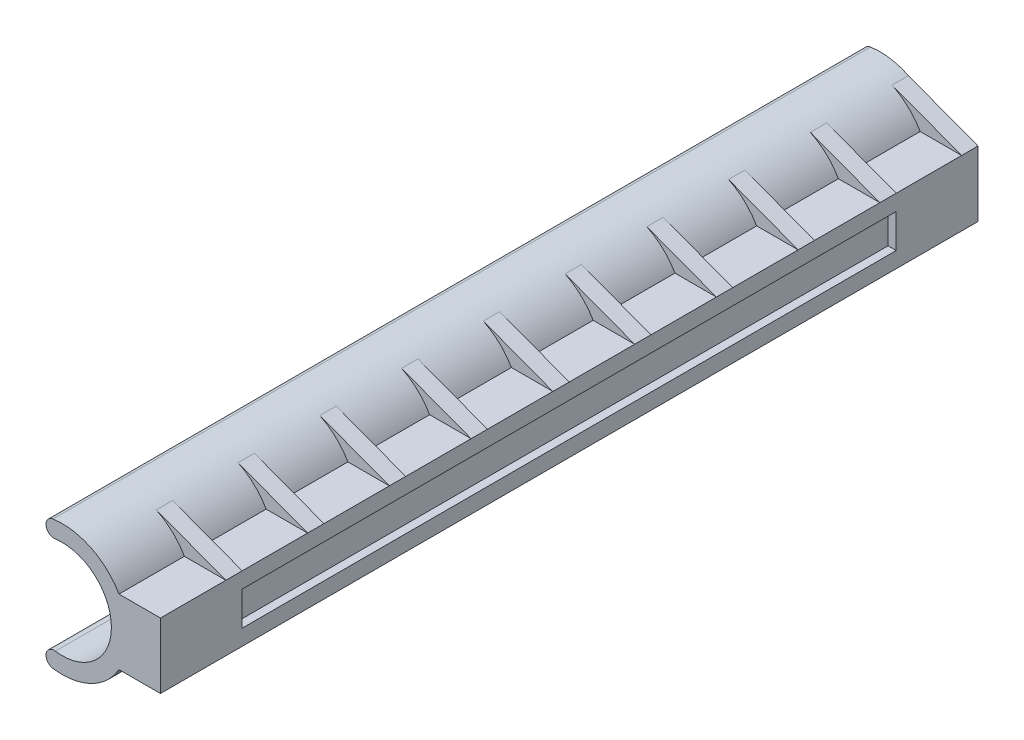
from build123d import *

# Parameters (mm, degrees)
BOSS_EXTRUDE1_DEPTH     = 500
BOSS_EXTRUDE2_START     = 30
SKETCH2_W               = 500
SKETCH2_H               = 40
BOSS_EXTRUDE2_DEPTH     = 30
RIB1_REACH              = 507.173
SKETCH4_WALL_W          = 1057.782982674
SKETCH4_WALL_H          = 10
LPATTERN1_COUNT         = 10
LPATTERN1_PITCH         = 50
MIRROR1_COPY_1_REACH    = 507.173
MIRROR1_COPY_1_SKETCH_W = 1057.782982674
MIRROR1_COPY_1_SKETCH_H = 10
MIRROR1_COPY_2_REACH    = 507.173
MIRROR1_COPY_2_SKETCH_W = 1057.782982674
MIRROR1_COPY_2_SKETCH_H = 10
MIRROR1_COPY_3_REACH    = 507.173
MIRROR1_COPY_3_SKETCH_W = 1057.782982674
MIRROR1_COPY_3_SKETCH_H = 10
MIRROR1_COPY_4_REACH    = 507.173
MIRROR1_COPY_4_SKETCH_W = 1057.782982674
MIRROR1_COPY_4_SKETCH_H = 10
MIRROR1_COPY_5_REACH    = 507.173
MIRROR1_COPY_5_SKETCH_W = 1057.782982674
MIRROR1_COPY_5_SKETCH_H = 10
MIRROR1_COPY_6_REACH    = 507.173
MIRROR1_COPY_6_SKETCH_W = 1057.782982674
MIRROR1_COPY_6_SKETCH_H = 10
MIRROR1_COPY_7_REACH    = 507.173
MIRROR1_COPY_7_SKETCH_W = 1057.782982674
MIRROR1_COPY_7_SKETCH_H = 10
MIRROR1_COPY_8_REACH    = 507.173
MIRROR1_COPY_8_SKETCH_W = 1057.782982674
MIRROR1_COPY_8_SKETCH_H = 10
MIRROR1_COPY_9_REACH    = 507.173
MIRROR1_COPY_9_SKETCH_W = 1057.782982674
MIRROR1_COPY_9_SKETCH_H = 10
SKETCH5_W               = 400
SKETCH5_H               = 20.700317686
CUT_EXTRUDE1_DEPTH      = 5


with BuildPart() as part:
    # Sketch1 → Boss-Extrude1 (new body)
    with BuildSketch(Plane.XY):
        with BuildLine():
            ThreePointArc((-5.714285714, 39.589732744), (-9.948716593, 33.926730437), (-4.285714286, 29.692299558))
            ThreePointArc((-4.285714286, 29.692299558), (30, 0), (-4.285714286, -29.692299558))
            ThreePointArc((-4.285714286, -29.692299558), (-9.948716593, -33.926730437), (-5.714285714, -39.589732744))
            ThreePointArc((-5.714285714, -39.589732744), (40, 0), (-5.714285714, 39.589732744))
        make_face()
    extrude(amount=BOSS_EXTRUDE1_DEPTH)

    # Sketch2 → Boss-Extrude2 (add)
    with BuildSketch(Plane(origin=(0, 0, 0), x_dir=(0, 0, -1), z_dir=(1, 0, 0)).offset(BOSS_EXTRUDE2_START)):
        with Locations((-250, 0)):
            Rectangle(SKETCH2_W, SKETCH2_H)
    extrude(amount=BOSS_EXTRUDE2_DEPTH)

    # Sketch4 wall → Rib1 (add, up to next)
    with BuildSketch(Plane(origin=(38.733961597, 27.992162595, 0), x_dir=(-0.936077158958, 0.351794759025, 0), z_dir=(0.351794759025, 0.936077158958, 0)), mode=Mode.PRIVATE) as rib1_sk1:
        with Locations((0, 5)):
            Rectangle(SKETCH4_WALL_W, SKETCH4_WALL_H)
    rib1_tool1 = extrude(rib1_sk1.sketch, amount=-RIB1_REACH, mode=Mode.PRIVATE) - part.part
    rib1 = rib1_tool1.solids().sort_by_distance((38.733961597, 27.992162595, 0))[0]
    add(rib1)

    # LPattern1: Rib1 ×10
    with Locations(*[(0, 0, i * LPATTERN1_PITCH) for i in range(1, LPATTERN1_COUNT)]):
        add(rib1)

    # Mirror1: Rib1 across plane
    add(rib1.mirror(Plane.ZX))

    # Mirror1 copy 1 sketch → Mirror1 copy 1 (add, up to next)
    with BuildSketch(Plane(origin=(38.733961597, -27.992162595, 50), x_dir=(-0.936077158958, -0.351794759025, 0), z_dir=(0.351794759025, -0.936077158958, 0)), mode=Mode.PRIVATE) as mirror1_copy_1_sk1:
        with Locations((0, -5)):
            Rectangle(MIRROR1_COPY_1_SKETCH_W, MIRROR1_COPY_1_SKETCH_H)
    mirror1_copy_1_tool1 = extrude(mirror1_copy_1_sk1.sketch, amount=-MIRROR1_COPY_1_REACH, mode=Mode.PRIVATE) - part.part
    add(mirror1_copy_1_tool1.solids().sort_by_distance((38.733961597, -27.992162595, 50))[0])

    # Mirror1 copy 2 sketch → Mirror1 copy 2 (add, up to next)
    with BuildSketch(Plane(origin=(38.733961597, -27.992162595, 100), x_dir=(-0.936077158958, -0.351794759025, 0), z_dir=(0.351794759025, -0.936077158958, 0)), mode=Mode.PRIVATE) as mirror1_copy_2_sk1:
        with Locations((0, -5)):
            Rectangle(MIRROR1_COPY_2_SKETCH_W, MIRROR1_COPY_2_SKETCH_H)
    mirror1_copy_2_tool1 = extrude(mirror1_copy_2_sk1.sketch, amount=-MIRROR1_COPY_2_REACH, mode=Mode.PRIVATE) - part.part
    add(mirror1_copy_2_tool1.solids().sort_by_distance((38.733961597, -27.992162595, 100))[0])

    # Mirror1 copy 3 sketch → Mirror1 copy 3 (add, up to next)
    with BuildSketch(Plane(origin=(38.733961597, -27.992162595, 150), x_dir=(-0.936077158958, -0.351794759025, 0), z_dir=(0.351794759025, -0.936077158958, 0)), mode=Mode.PRIVATE) as mirror1_copy_3_sk1:
        with Locations((0, -5)):
            Rectangle(MIRROR1_COPY_3_SKETCH_W, MIRROR1_COPY_3_SKETCH_H)
    mirror1_copy_3_tool1 = extrude(mirror1_copy_3_sk1.sketch, amount=-MIRROR1_COPY_3_REACH, mode=Mode.PRIVATE) - part.part
    add(mirror1_copy_3_tool1.solids().sort_by_distance((38.733961597, -27.992162595, 150))[0])

    # Mirror1 copy 4 sketch → Mirror1 copy 4 (add, up to next)
    with BuildSketch(Plane(origin=(38.733961597, -27.992162595, 200), x_dir=(-0.936077158958, -0.351794759025, 0), z_dir=(0.351794759025, -0.936077158958, 0)), mode=Mode.PRIVATE) as mirror1_copy_4_sk1:
        with Locations((0, -5)):
            Rectangle(MIRROR1_COPY_4_SKETCH_W, MIRROR1_COPY_4_SKETCH_H)
    mirror1_copy_4_tool1 = extrude(mirror1_copy_4_sk1.sketch, amount=-MIRROR1_COPY_4_REACH, mode=Mode.PRIVATE) - part.part
    add(mirror1_copy_4_tool1.solids().sort_by_distance((38.733961597, -27.992162595, 200))[0])

    # Mirror1 copy 5 sketch → Mirror1 copy 5 (add, up to next)
    with BuildSketch(Plane(origin=(38.733961597, -27.992162595, 250), x_dir=(-0.936077158958, -0.351794759025, 0), z_dir=(0.351794759025, -0.936077158958, 0)), mode=Mode.PRIVATE) as mirror1_copy_5_sk1:
        with Locations((0, -5)):
            Rectangle(MIRROR1_COPY_5_SKETCH_W, MIRROR1_COPY_5_SKETCH_H)
    mirror1_copy_5_tool1 = extrude(mirror1_copy_5_sk1.sketch, amount=-MIRROR1_COPY_5_REACH, mode=Mode.PRIVATE) - part.part
    add(mirror1_copy_5_tool1.solids().sort_by_distance((38.733961597, -27.992162595, 250))[0])

    # Mirror1 copy 6 sketch → Mirror1 copy 6 (add, up to next)
    with BuildSketch(Plane(origin=(38.733961597, -27.992162595, 300), x_dir=(-0.936077158958, -0.351794759025, 0), z_dir=(0.351794759025, -0.936077158958, 0)), mode=Mode.PRIVATE) as mirror1_copy_6_sk1:
        with Locations((0, -5)):
            Rectangle(MIRROR1_COPY_6_SKETCH_W, MIRROR1_COPY_6_SKETCH_H)
    mirror1_copy_6_tool1 = extrude(mirror1_copy_6_sk1.sketch, amount=-MIRROR1_COPY_6_REACH, mode=Mode.PRIVATE) - part.part
    add(mirror1_copy_6_tool1.solids().sort_by_distance((38.733961597, -27.992162595, 300))[0])

    # Mirror1 copy 7 sketch → Mirror1 copy 7 (add, up to next)
    with BuildSketch(Plane(origin=(38.733961597, -27.992162595, 350), x_dir=(-0.936077158958, -0.351794759025, 0), z_dir=(0.351794759025, -0.936077158958, 0)), mode=Mode.PRIVATE) as mirror1_copy_7_sk1:
        with Locations((0, -5)):
            Rectangle(MIRROR1_COPY_7_SKETCH_W, MIRROR1_COPY_7_SKETCH_H)
    mirror1_copy_7_tool1 = extrude(mirror1_copy_7_sk1.sketch, amount=-MIRROR1_COPY_7_REACH, mode=Mode.PRIVATE) - part.part
    add(mirror1_copy_7_tool1.solids().sort_by_distance((38.733961597, -27.992162595, 350))[0])

    # Mirror1 copy 8 sketch → Mirror1 copy 8 (add, up to next)
    with BuildSketch(Plane(origin=(38.733961597, -27.992162595, 400), x_dir=(-0.936077158958, -0.351794759025, 0), z_dir=(0.351794759025, -0.936077158958, 0)), mode=Mode.PRIVATE) as mirror1_copy_8_sk1:
        with Locations((0, -5)):
            Rectangle(MIRROR1_COPY_8_SKETCH_W, MIRROR1_COPY_8_SKETCH_H)
    mirror1_copy_8_tool1 = extrude(mirror1_copy_8_sk1.sketch, amount=-MIRROR1_COPY_8_REACH, mode=Mode.PRIVATE) - part.part
    add(mirror1_copy_8_tool1.solids().sort_by_distance((38.733961597, -27.992162595, 400))[0])

    # Mirror1 copy 9 sketch → Mirror1 copy 9 (add, up to next)
    with BuildSketch(Plane(origin=(38.733961597, -27.992162595, 450), x_dir=(-0.936077158958, -0.351794759025, 0), z_dir=(0.351794759025, -0.936077158958, 0)), mode=Mode.PRIVATE) as mirror1_copy_9_sk1:
        with Locations((0, -5)):
            Rectangle(MIRROR1_COPY_9_SKETCH_W, MIRROR1_COPY_9_SKETCH_H)
    mirror1_copy_9_tool1 = extrude(mirror1_copy_9_sk1.sketch, amount=-MIRROR1_COPY_9_REACH, mode=Mode.PRIVATE) - part.part
    add(mirror1_copy_9_tool1.solids().sort_by_distance((38.733961597, -27.992162595, 450))[0])

    # Sketch5 → Cut-Extrude1 (cut)
    with BuildSketch(Plane(origin=(60, 0, 0), x_dir=(0, 0, -1), z_dir=(1, 0, 0))):
        with Locations((-250, 0)):
            Rectangle(SKETCH5_W, SKETCH5_H)
    extrude(amount=-CUT_EXTRUDE1_DEPTH, mode=Mode.SUBTRACT)


solid = part.part
